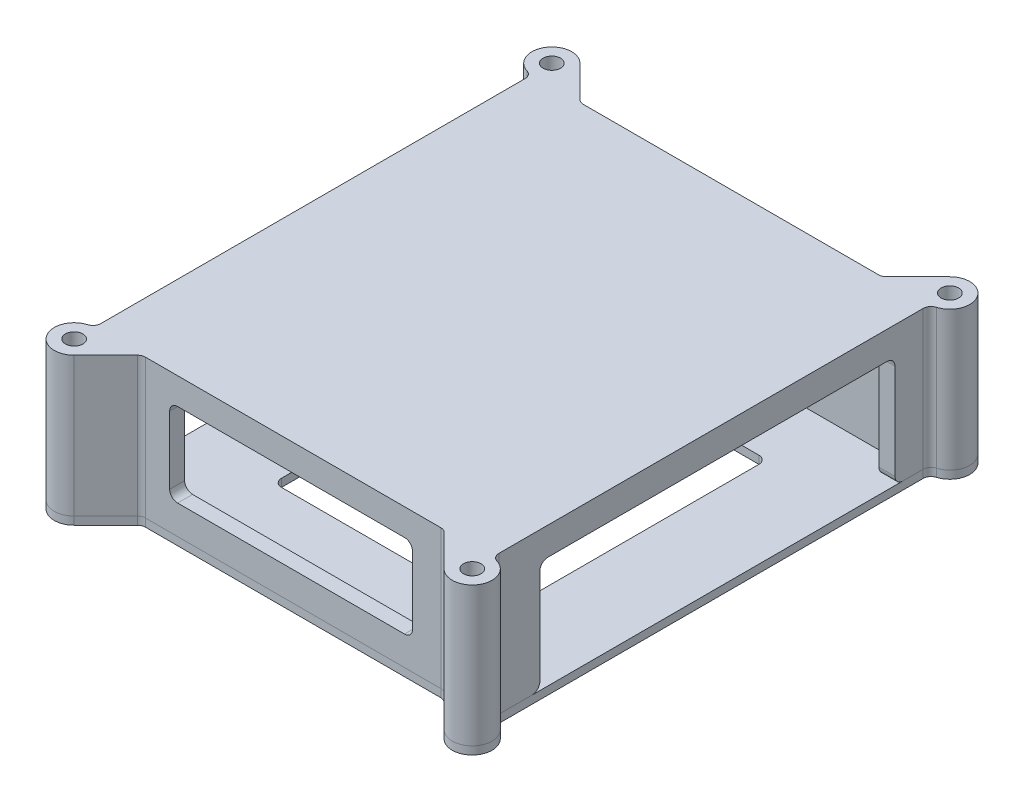
from build123d import *

# Parameters (mm, degrees)
SKETCH1_W           = 127
SKETCH1_H           = 139.7
BOSS_EXTRUDE1_DEPTH = 44.45
SKETCH3_W           = 115.57
SKETCH3_H           = 131.064
CUT_EXTRUDE1_DEPTH  = 44
SKETCH4_W           = 77.47
SKETCH4_H           = 26.67
CUT_EXTRUDE2_DEPTH  = 190.754
SKETCH5_W           = 113.284
SKETCH5_H           = 46.99
CUT_EXTRUDE3_DEPTH  = 190.754
SKETCH6_R           = 6.35
SKETCH6_R_2         = 2.794
BOSS_EXTRUDE2_DEPTH = 44.45
FILLET1_R           = 2.54
SKETCH7_R           = 2.794
SKETCH7_W           = 72.32591523
SKETCH7_H           = 85.062554391
BOSS_EXTRUDE3_DEPTH = 2.54
FILLET2_R           = 2.54


with BuildPart() as part:
    # Sketch1 → Boss-Extrude1 (new body)
    with BuildSketch(Plane(origin=(0, 0, 0), x_dir=(1, 0, 0), z_dir=(0, 1, 0))):
        with Locations((63.5, 69.85)):
            Rectangle(SKETCH1_W, SKETCH1_H)
    extrude(amount=BOSS_EXTRUDE1_DEPTH)

    # Sketch3 → Cut-Extrude1 (cut)
    with BuildSketch(Plane.XZ):
        with Locations((64.135, -70.2945)):
            Rectangle(SKETCH3_W, SKETCH3_H)
    extrude(amount=-CUT_EXTRUDE1_DEPTH, mode=Mode.SUBTRACT)

    # Sketch4 → Cut-Extrude2 (cut)
    with BuildSketch(Plane(origin=(0, 0, -139.7), x_dir=(-1, 0, 0), z_dir=(0, 0, -1))):
        with Locations((-62.865, 22.606)):
            Rectangle(SKETCH4_W, SKETCH4_H)
    extrude(amount=-CUT_EXTRUDE2_DEPTH, mode=Mode.SUBTRACT)

    # Sketch5 → Cut-Extrude3 (cut)
    with BuildSketch(Plane(origin=(127, 0, 0), x_dir=(0, 0, -1), z_dir=(1, 0, 0))):
        with Locations((71.882, 12.065)):
            Rectangle(SKETCH5_W, SKETCH5_H)
    extrude(amount=-CUT_EXTRUDE3_DEPTH, mode=Mode.SUBTRACT)

    # Sketch6 → Boss-Extrude2 (add, through all)
    # profile 1 of 8: a face of its own
    with BuildSketch(Plane(origin=(0, 0, 0), x_dir=(-1, 0, 0), z_dir=(0, -1, 0))):
        with Locations((-127, 146.05)):
            Circle(SKETCH6_R)
        with Locations(Location((-127, 146.05, 0), (0, 0, 90))):
            Circle(SKETCH6_R_2, mode=Mode.SUBTRACT)
    # profile 2 of 8: a face of its own
    with BuildSketch(Plane(origin=(0, 0, 0), x_dir=(-1, 0, 0), z_dir=(0, -1, 0))):
        with BuildLine():
            Line((-111.669743879, 139.7), (-122.509871939, 150.540128061))
            ThreePointArc((-122.509871939, 150.540128061), (-121.133364969, 148.480039796), (-120.65, 146.05))
            ThreePointArc((-120.65, 146.05), (-122.509871939, 141.559871939), (-127, 139.7))
            Line((-127, 139.7), (-111.669743879, 139.7))
        make_face()
    # profile 3 of 8: a face of its own
    with BuildSketch(Plane(origin=(0, 0, 0), x_dir=(-1, 0, 0), z_dir=(0, -1, 0))):
        with BuildLine():
            Line((-4.490128061, 150.540128061), (-15.330256121, 139.7))
            Line((-15.330256121, 139.7), (0, 139.7))
            ThreePointArc((0, 139.7), (-5.866635031, 143.619960204), (-4.490128061, 150.540128061))
        make_face()
    # profile 4 of 8: a face of its own
    with BuildSketch(Plane(origin=(0, 0, 0), x_dir=(-1, 0, 0), z_dir=(0, -1, 0))):
        with Locations((-127, -6.35)):
            Circle(SKETCH6_R)
        with Locations(Location((-127, -6.35, 0), (0, 0, 90))):
            Circle(SKETCH6_R_2, mode=Mode.SUBTRACT)
    # profile 5 of 8: a face of its own
    with BuildSketch(Plane(origin=(0, 0, 0), x_dir=(-1, 0, 0), z_dir=(0, -1, 0))):
        with BuildLine():
            Line((-122.509871939, -10.840128061), (-111.669743879, 0))
            Line((-111.669743879, 0), (-127, 0))
            ThreePointArc((-127, 0), (-122.509871939, -1.859871939), (-120.65, -6.35))
            ThreePointArc((-120.65, -6.35), (-121.133364969, -8.780039796), (-122.509871939, -10.840128061))
        make_face()
    # profile 6 of 8: a face of its own
    with BuildSketch(Plane(origin=(0, 0, 0), x_dir=(-1, 0, 0), z_dir=(0, -1, 0))):
        with BuildLine():
            Line((-15.330256121, 0), (-4.490128061, -10.840128061))
            ThreePointArc((-4.490128061, -10.840128061), (-5.866635031, -3.919960204), (0, 0))
            Line((0, 0), (-15.330256121, 0))
        make_face()
    # profile 7 of 8: a face of its own
    with BuildSketch(Plane(origin=(0, 0, 0), x_dir=(-1, 0, 0), z_dir=(0, -1, 0))):
        with Locations((0, -6.35)):
            Circle(SKETCH6_R)
        with Locations(Location((0, -6.35, 0), (0, 0, 90))):
            Circle(SKETCH6_R_2, mode=Mode.SUBTRACT)
    # profile 8 of 8: a face of its own
    with BuildSketch(Plane(origin=(0, 0, 0), x_dir=(-1, 0, 0), z_dir=(0, -1, 0))):
        with Locations((0, 146.05)):
            Circle(SKETCH6_R)
        with Locations(Location((0, 146.05, 0), (0, 0, 90))):
            Circle(SKETCH6_R_2, mode=Mode.SUBTRACT)
    extrude(amount=-BOSS_EXTRUDE2_DEPTH)

    # Fillet1
    fillet1_edges = [part.edges().sort_by_distance(p)[0] for p in [
        (111.669743879, 22.225, 0),
        (15.330256121, 22.225, 0),
        (15.330256121, 22.225, -139.7),
        (101.6, 9.271, -2.38125),
        (101.6, 9.271, -137.76325),
        (101.6, 35.941, -2.38125),
        (101.6, 35.941, -137.76325),
        (24.13, 35.941, -2.38125),
        (24.13, 35.941, -137.76325),
        (24.13, 9.271, -2.38125),
        (24.13, 9.271, -137.76325),
        (124.46, 0, -15.24),
        (3.175, 0, -15.24),
        (3.175, 35.56, -15.24),
        (124.46, 35.56, -15.24),
        (3.175, 35.56, -128.524),
        (3.175, 0, -128.524),
        (124.46, 0, -128.524),
        (124.46, 35.56, -128.524),
        (0, 22.225, -139.7),
        (127, 22.225, -139.7),
        (127, 22.225, 0),
        (0, 22.225, 0),
        (111.669743879, 22.225, -139.7),
    ]]
    fillet(fillet1_edges, radius=FILLET1_R)


with BuildPart() as body_2:
    # Sketch7 → Boss-Extrude3 (new body)
    with BuildSketch(Plane.XZ):
        with BuildLine():
            Line((127, -12.7), (127, -2.169418994))
            ThreePointArc((127, -2.169418994), (127.503469337, -0.65147866), (128.814285714, 0.264700718))
            ThreePointArc((128.814285714, 0.264700718), (132.454351376, 9.60154595), (122.509871939, 10.840128061))
            Line((122.509871939, 10.840128061), (112.413692655, 0.743948776))
            ThreePointArc((112.413692655, 0.743948776), (111.589657349, 0.193345987), (110.617641431, 0))
            Line((110.617641431, 0), (16.382358569, 0))
            ThreePointArc((16.382358569, 0), (15.410342651, 0.193345987), (14.586307345, 0.743948776))
            Line((14.586307345, 0.743948776), (4.490128061, 10.840128061))
            ThreePointArc((4.490128061, 10.840128061), (-5.454351376, 9.60154595), (-1.814285714, 0.264700718))
            ThreePointArc((-1.814285714, 0.264700718), (-0.503469337, -0.65147866), (0, -2.169418994))
            Line((0, -2.169418994), (0, -12.7))
            Line((0, -12.7), (0, -131.064))
            Line((0, -131.064), (0, -137.530581006))
            ThreePointArc((0, -137.530581006), (-0.503469337, -139.04852134), (-1.814285714, -139.964700718))
            ThreePointArc((-1.814285714, -139.964700718), (-5.454351376, -149.30154595), (4.490128061, -150.540128061))
            Line((4.490128061, -150.540128061), (14.586307345, -140.443948776))
            ThreePointArc((14.586307345, -140.443948776), (15.410342651, -139.893345987), (16.382358569, -139.7))
            Line((16.382358569, -139.7), (110.617641431, -139.7))
            ThreePointArc((110.617641431, -139.7), (111.589657349, -139.893345987), (112.413692655, -140.443948776))
            Line((112.413692655, -140.443948776), (122.509871939, -150.540128061))
            ThreePointArc((122.509871939, -150.540128061), (132.454351376, -149.30154595), (128.814285714, -139.964700718))
            ThreePointArc((128.814285714, -139.964700718), (127.503469337, -139.04852134), (127, -137.530581006))
            Line((127, -137.530581006), (127, -131.064))
            Line((127, -131.064), (127, -12.7))
        make_face()
        with Locations(Location((127, -146.05, 0), (0, 0, 270))):
            Circle(SKETCH7_R, mode=Mode.SUBTRACT)
        with Locations(Location((0, -146.05, 0), (0, 0, 270))):
            Circle(SKETCH7_R, mode=Mode.SUBTRACT)
        with Locations(Location((127, 6.35, 0), (0, 0, 270))):
            Circle(SKETCH7_R, mode=Mode.SUBTRACT)
        with Locations(Location((0, 6.35, 0), (0, 0, 270))):
            Circle(SKETCH7_R, mode=Mode.SUBTRACT)
        with Locations((63.272560015, -72.692999813)):
            Rectangle(SKETCH7_W, SKETCH7_H, mode=Mode.SUBTRACT)
    extrude(amount=BOSS_EXTRUDE3_DEPTH)

    # Fillet2
    fillet2_edges = [body_2.edges().sort_by_distance(p)[0] for p in [
        (27.1096024, -1.27, -30.161722617),
        (27.1096024, -1.27, -115.224277008),
        (99.43551763, -1.27, -115.224277008),
        (99.43551763, -1.27, -30.161722617),
    ]]
    fillet(fillet2_edges, radius=FILLET2_R)


solid = Compound([part.part, body_2.part])
